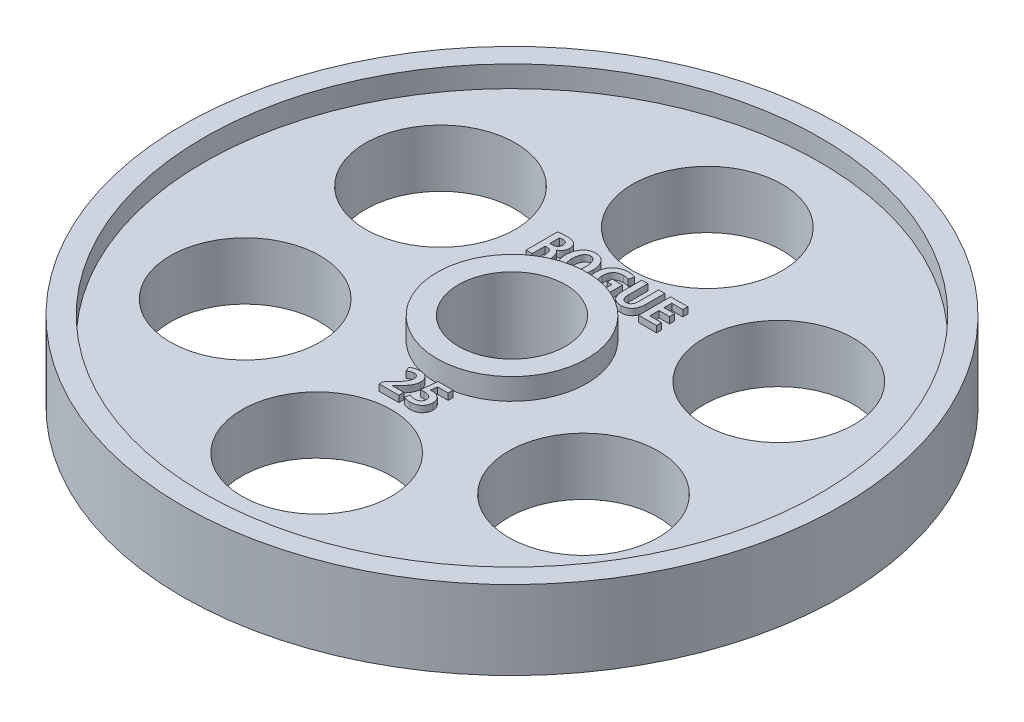
from build123d import *

# Parameters (mm, degrees)
SKETCH1_R               = 154
SKETCH1_R_2             = 25
BOSS_EXTRUDE1_DEPTH     = 18.415
SKETCH2_R               = 144
SKETCH2_R_2             = 35
CUT_EXTRUDE2_DEPTH      = 10
CUT_EXTRUDE3_DEPTH      = 220.435295475
CUT_EXTRUDE3_DEPTH_BACK = 220.435295475
SKETCH3_R               = 35
BOSS_EXTRUDE2_DEPTH     = 3


with BuildPart() as part:
    # Sketch1 → Boss-Extrude1 (new, symmetric)
    with BuildSketch(Plane(origin=(0, 0, 0), x_dir=(1, 0, 0), z_dir=(0, 1, 0))):
        with Locations(Location((0, 0, 0), (0, 0, 270))):
            Circle(SKETCH1_R)
        with Locations(Location((0, 0, 0), (0, 0, 270))):
            Circle(SKETCH1_R_2, mode=Mode.SUBTRACT)
    extrude(amount=BOSS_EXTRUDE1_DEPTH, both=True)

    # Sketch2 → Cut-Extrude2 (cut)
    with BuildSketch(Plane(origin=(0, 18.415, 0), x_dir=(1, 0, 0), z_dir=(0, 1, 0))):
        with Locations(Location((0, 0, 0), (0, 0, 270))):
            Circle(SKETCH2_R)
        with Locations(Location((0, 0, 0), (0, 0, 270))):
            Circle(SKETCH2_R_2, mode=Mode.SUBTRACT)
    extrude(amount=-CUT_EXTRUDE2_DEPTH, mode=Mode.SUBTRACT)

    # Sketch3 → Cut-Extrude3 (cut, two sides: drawn at the far end of the back side and taken through both)
    with BuildSketch(Plane(origin=(0, 8.415, 0), x_dir=(1, 0, 0), z_dir=(0, 1, 0)).offset(-CUT_EXTRUDE3_DEPTH_BACK)):
        with Locations(Location((0, 91.272564554, 0), (0, 0, 270))):
            Circle(SKETCH3_R)
        with Locations(Location((79.044359572, 45.636282277, 0), (0, 0, 270))):
            Circle(SKETCH3_R)
        with Locations(Location((79.044359572, -45.636282277, 0), (0, 0, 270))):
            Circle(SKETCH3_R)
        with Locations(Location((0, -91.272564554, 0), (0, 0, 270))):
            Circle(SKETCH3_R)
        with Locations(Location((-79.044359572, -45.636282277, 0), (0, 0, 270))):
            Circle(SKETCH3_R)
        with Locations(Location((-79.044359572, 45.636282277, 0), (0, 0, 270))):
            Circle(SKETCH3_R)
    extrude(amount=CUT_EXTRUDE3_DEPTH + CUT_EXTRUDE3_DEPTH_BACK, mode=Mode.SUBTRACT)

    # Sketch4 → Boss-Extrude2 (add)
    # profile 1 of 7: a face of its own
    with BuildSketch(Plane(origin=(0, 8.415, 0), x_dir=(1, 0, 0), z_dir=(0, 1, 0))):
        with BuildLine():
            Line((-30.195992688, 36.730082873), (-27.341586727, 36.730082873))
            Line((-27.341586727, 36.730082873), (-27.341586727, 42.843450395))
            Line((-27.341586727, 42.843450395), (-26.37254528, 42.843450395))
            add(Edge.make_bspline(
                [(-26.37254528, 42.843450395), (-26.291876974, 42.842870988), (-26.134950563, 42.84174385), (-25.906576065, 42.818650505), (-25.691744536, 42.780511356), (-25.490805471, 42.721616943), (-25.304979018, 42.641940527), (-25.131693034, 42.547550448), (-24.976709732, 42.430126424), (-24.833193615, 42.296508556), (-24.702812873, 42.137867029), (-24.578276061, 41.955666678), (-24.468617772, 41.742441474), (-24.359489708, 41.506724645), (-24.267338885, 41.241019796), (-24.175107893, 40.951645529), (-24.098559644, 40.63270231), (-24.052932627, 40.410597956), (-24.029242836, 40.295280187)],
                knots=[0, 0, 0, 0, 1.001974666, 1.949170552, 2.84847504, 3.710096242, 4.544408109, 5.357094972, 6.155407276, 6.953973995, 7.788367017, 8.701791117, 9.690949389, 10.763842173, 11.927092208, 13.182233812, 14.537000723, 16, 16, 16, 16], degree=3))
            add(Edge.make_bspline(
                [(-24.029242836, 40.295280187), (-23.986148772, 40.075013954), (-23.903305191, 39.651576428), (-23.769834223, 39.047264957), (-23.645923337, 38.497346562), (-23.518930314, 38.010195589), (-23.403370031, 37.586033626), (-23.292902241, 37.234752106), (-23.201953649, 36.952892164), (-23.132194418, 36.795236115), (-23.10212368, 36.727276165)],
                knots=[0, 0, 0, 0, 1.458923133, 2.804618726, 4.022904405, 5.122896265, 6.077023435, 6.879967071, 7.517193397, 8, 8, 8, 8], degree=3))
            Line((-23.10212368, 36.727276165), (-20.164487704, 36.730082873))
            add(Edge.make_bspline(
                [(-20.164487704, 36.730082873), (-20.2040284, 36.82035402), (-20.295051934, 37.028160147), (-20.408288543, 37.393268232), (-20.539719843, 37.842209777), (-20.671101356, 38.368245616), (-20.813191009, 38.95078505), (-20.95655604, 39.570908383), (-21.113597794, 40.216974747), (-21.215532704, 40.657598901), (-21.267551533, 40.882455652)],
                knots=[0, 0, 0, 0, 0.549570025, 1.265122049, 2.130097267, 3.160546163, 4.289861562, 5.476300611, 6.712120432, 8, 8, 8, 8], degree=3))
            add(Edge.make_bspline(
                [(-21.267551533, 40.882455652), (-21.311298371, 41.066869565), (-21.395464915, 41.421671937), (-21.566789194, 41.92145592), (-21.758260808, 42.373526307), (-21.979912128, 42.775345748), (-22.232437292, 43.127892144), (-22.529497451, 43.420680062), (-22.863472241, 43.662321829), (-23.112078583, 43.775513308), (-23.236977376, 43.832380237)],
                knots=[0, 0, 0, 0, 1.229855108, 2.366174558, 3.425587808, 4.413573034, 5.340237738, 6.230192189, 7.110855911, 8, 8, 8, 8], degree=3))
            Line((-23.236977376, 43.832380237), (-23.234612388, 43.891644859))
            add(Edge.make_bspline(
                [(-23.234612388, 43.891644859), (-23.061254494, 43.966844309), (-22.715291119, 44.116916827), (-22.244682652, 44.436991127), (-21.812618957, 44.816665151), (-21.493251384, 45.18572608), (-21.26948485, 45.513514513), (-21.120657107, 45.774521024), (-20.992970384, 46.048646427), (-20.889820458, 46.336882216), (-20.80460181, 46.637924005), (-20.743534336, 46.953690571), (-20.703387951, 47.282336984), (-20.695574684, 47.506092381), (-20.691613876, 47.619521514)],
                knots=[0, 0, 0, 0, 1.415251057, 2.824359598, 4.248283838, 5.723142377, 6.47158846, 7.223785845, 7.975195039, 8.737661918, 9.518558112, 10.320635523, 11.148673685, 12, 12, 12, 12], degree=3))
            add(Edge.make_bspline(
                [(-20.691613876, 47.619521514), (-20.699577699, 47.735785503), (-20.715228041, 47.96426511), (-20.761947453, 48.29669692), (-20.817314146, 48.613848946), (-20.886640251, 48.913363356), (-20.971724985, 49.196527111), (-21.069459015, 49.463325738), (-21.181034353, 49.713641517), (-21.308894192, 49.946070554), (-21.449419942, 50.161493337), (-21.5997885, 50.363910194), (-21.771392036, 50.542344043), (-21.950541553, 50.711168416), (-22.148011312, 50.858303629), (-22.357319267, 50.992720336), (-22.581925244, 51.106815879), (-22.895633034, 51.235379132), (-23.293653865, 51.367024164), (-23.762292694, 51.514081714), (-24.223934938, 51.624346886), (-24.671257076, 51.716881545), (-25.108820927, 51.776659736), (-25.534147072, 51.819711254), (-25.949223145, 51.826762424), (-26.221595344, 51.8144608), (-26.35546908, 51.808414425)],
                knots=[0, 0, 0, 0, 1.04254728, 2.048792541, 3.00224853, 3.923105087, 4.79804786, 5.646501919, 6.464227683, 7.248100506, 8.017504481, 8.765055913, 9.500244792, 10.229727568, 10.965537121, 11.700200404, 12.45355415, 13.216173449, 14.732128481, 16.203485081, 17.610025167, 18.977448705, 20.289434687, 21.560307215, 22.800865913, 24, 24, 24, 24], degree=3))
            add(Edge.make_bspline(
                [(-26.35546908, 51.808414425), (-26.713312889, 51.804207447), (-27.412743878, 51.795984612), (-28.271518631, 51.739564306), (-28.922795666, 51.678663381), (-29.374301325, 51.628445571), (-29.796879694, 51.572968413), (-30.067787327, 51.529044737), (-30.198799397, 51.507803063)],
                knots=[0, 0, 0, 0, 1.668967631, 3.262115064, 4.012317135, 4.719957541, 5.380966089, 6, 6, 6, 6], degree=3))
            Line((-30.198799397, 51.507803063), (-30.195992688, 36.730082873))
        make_face()
        with BuildLine():
            add(Edge.make_bspline(
                [(-27.341586727, 49.558688132), (-27.270702609, 49.576857816), (-27.104631745, 49.619426662), (-26.811201348, 49.649331291), (-26.442979082, 49.67263841), (-26.171988269, 49.673021594), (-26.023953746, 49.673230916)],
                knots=[0, 0, 0, 0, 0.661277559, 1.549274193, 2.661238647, 4, 4, 4, 4], degree=3))
            add(Edge.make_bspline(
                [(-26.023953746, 49.673230916), (-25.885029367, 49.674023883), (-25.605862266, 49.67561734), (-25.189911715, 49.594928594), (-24.781074105, 49.454596624), (-24.450001772, 49.291369662), (-24.201934162, 49.119048254), (-24.036448396, 48.955960473), (-23.896313482, 48.762461664), (-23.775573111, 48.540420193), (-23.687094776, 48.286069623), (-23.611700164, 48.005886033), (-23.565508919, 47.694842409), (-23.552698442, 47.477314041), (-23.546017094, 47.363861384)],
                knots=[0, 0, 0, 0, 1.292083092, 2.596427594, 3.923894466, 5.313341569, 6.020452472, 6.730143688, 7.466744382, 8.239869291, 9.076443159, 9.969725277, 10.941103348, 12, 12, 12, 12], degree=3))
            add(Edge.make_bspline(
                [(-23.546017094, 47.363861384), (-23.549193735, 47.275719168), (-23.555400979, 47.103486869), (-23.589838527, 46.852509133), (-23.642744322, 46.614212209), (-23.717658693, 46.389404079), (-23.817995379, 46.178967197), (-23.937837195, 45.982461754), (-24.081085413, 45.801376587), (-24.240251225, 45.632080002), (-24.420547284, 45.480781704), (-24.617542987, 45.34736545), (-24.834622093, 45.237888536), (-25.066809261, 45.145621435), (-25.316853295, 45.071763331), (-25.583085971, 45.019793179), (-25.866679572, 44.984988317), (-26.061306891, 44.97894295), (-26.161616893, 44.975827196)],
                knots=[0, 0, 0, 0, 1.059346065, 2.069991167, 3.039184971, 3.989375718, 4.910601955, 5.835121727, 6.749101981, 7.680445877, 8.622807178, 9.571664136, 10.532985652, 11.538164881, 12.57081342, 13.661090204, 14.794536924, 16, 16, 16, 16], degree=3))
            Line((-26.161616893, 44.975827196), (-27.341586727, 44.978633904))
            Line((-27.341586727, 44.978633904), (-27.341586727, 49.558688132))
        make_face(mode=Mode.SUBTRACT)
    # profile 2 of 7: a face of its own
    with BuildSketch(Plane(origin=(0, 8.415, 0), x_dir=(1, 0, 0), z_dir=(0, 1, 0))):
        with BuildLine():
            add(Edge.make_bspline(
                [(-12.659341264, 51.811221134), (-12.900480274, 51.799083816), (-13.372110368, 51.775345126), (-14.057360089, 51.660936845), (-14.703122441, 51.487711867), (-15.309491549, 51.248425834), (-15.874019023, 50.939429117), (-16.399646464, 50.568800272), (-16.887629926, 50.136652161), (-17.325228383, 49.637373289), (-17.721353053, 49.08993816), (-18.067791256, 48.498215799), (-18.360179335, 47.8653206), (-18.601788639, 47.193964679), (-18.79366347, 46.482866291), (-18.929523418, 45.731014328), (-19.014785231, 44.939347991), (-19.029386324, 44.398232949), (-19.036846657, 44.121753792)],
                knots=[0, 0, 0, 0, 1.033979396, 2.022301571, 2.970529521, 3.894611869, 4.808705929, 5.721706953, 6.645545269, 7.595046225, 8.560760165, 9.537443814, 10.528556773, 11.544132656, 12.591621816, 13.681030908, 14.81513806, 16, 16, 16, 16], degree=3))
            add(Edge.make_bspline(
                [(-19.036846657, 44.121753792), (-19.031338856, 43.85277336), (-19.020548559, 43.325815479), (-18.939458024, 42.555253129), (-18.815031902, 41.821422712), (-18.638049947, 41.124976585), (-18.410613257, 40.466142148), (-18.134193444, 39.844828273), (-17.810385346, 39.25998082), (-17.438136315, 38.716254082), (-17.021741983, 38.219404302), (-16.554927874, 37.785648789), (-16.042556311, 37.419749578), (-15.490524826, 37.112065236), (-14.892232981, 36.873583387), (-14.251699555, 36.697141584), (-13.567933174, 36.582694834), (-13.097177448, 36.561259866), (-12.856052288, 36.55028069)],
                knots=[0, 0, 0, 0, 1.175398352, 2.302715549, 3.382711972, 4.426044826, 5.439559783, 6.425314094, 7.394529886, 8.35725084, 9.301097905, 10.222100453, 11.134210928, 12.046578501, 12.977639436, 13.941864418, 14.945805126, 16, 16, 16, 16], degree=3))
            add(Edge.make_bspline(
                [(-12.856052288, 36.55028069), (-12.62535132, 36.55596007), (-12.172325123, 36.567112635), (-11.511702794, 36.662135898), (-10.884366178, 36.813453129), (-10.291796956, 37.026631877), (-9.733908436, 37.305480882), (-9.208686548, 37.641906604), (-8.72386152, 38.047289776), (-8.268891112, 38.503944919), (-7.860597602, 39.025734751), (-7.505388868, 39.610137779), (-7.201273823, 40.254153546), (-6.953207056, 40.95887109), (-6.756454759, 41.722159888), (-6.615348693, 42.54529138), (-6.525411155, 43.428724266), (-6.507492471, 44.038189451), (-6.498262443, 44.352128855)],
                knots=[0, 0, 0, 0, 0.973215927, 1.911098665, 2.810233662, 3.692878859, 4.562482505, 5.437306462, 6.318818337, 7.224297875, 8.153278156, 9.107653746, 10.104740014, 11.153537043, 12.255914066, 13.4274303, 14.674852943, 16, 16, 16, 16], degree=3))
            add(Edge.make_bspline(
                [(-6.498262443, 44.352128855), (-6.501904913, 44.603305458), (-6.50907013, 45.097402934), (-6.585553962, 45.822807851), (-6.701821959, 46.519784813), (-6.867087352, 47.188318673), (-7.084316204, 47.827887036), (-7.348779918, 48.438400913), (-7.658929472, 49.021181892), (-8.016536265, 49.570206278), (-8.420259335, 50.077474431), (-8.87931891, 50.523051522), (-9.389354363, 50.902613751), (-9.949829095, 51.215840755), (-10.559122134, 51.462892913), (-11.215229832, 51.649434749), (-11.921293093, 51.766940496), (-12.408916269, 51.794340193), (-12.659390649, 51.808414425)],
                knots=[0, 0, 0, 0, 1.108815589, 2.181186377, 3.217324289, 4.227359111, 5.218662007, 6.196651342, 7.162419235, 8.130521869, 9.086401898, 10.019355721, 10.947374437, 11.886103195, 12.846837522, 13.844349182, 14.892720183, 16, 16, 16, 16], degree=3))
            Line((-12.659390649, 51.808414425), (-12.659341264, 51.811221134))
        make_face()
        with BuildLine():
            add(Edge.make_bspline(
                [(-12.737182838, 49.496229954), (-12.604111217, 49.484163343), (-12.344709374, 49.460641414), (-11.969692732, 49.377189854), (-11.621790013, 49.242881247), (-11.301060652, 49.063026843), (-11.006554094, 48.836270008), (-10.739104551, 48.56513545), (-10.499166133, 48.247351257), (-10.29092283, 47.886754753), (-10.109889045, 47.495350037), (-9.943962016, 47.085019412), (-9.811799715, 46.653579285), (-9.697783415, 46.205820419), (-9.611633894, 45.739278589), (-9.550078205, 45.254382693), (-9.51282441, 44.751663127), (-9.509084207, 44.410254791), (-9.50718552, 44.236941323)],
                knots=[0, 0, 0, 0, 0.936463798, 1.82548641, 2.684127786, 3.542744044, 4.395260201, 5.282267079, 6.205678022, 7.180000722, 8.196506421, 9.228258241, 10.281381103, 11.358157126, 12.467215955, 13.606035564, 14.784721301, 16, 16, 16, 16], degree=3))
            add(Edge.make_bspline(
                [(-9.50718552, 44.236941323), (-9.509980285, 44.049572581), (-9.515464306, 43.681908631), (-9.555574035, 43.142728971), (-9.618919533, 42.628615127), (-9.709568691, 42.139016498), (-9.823446598, 41.67421456), (-9.963041689, 41.233022267), (-10.134058681, 40.819627905), (-10.321135899, 40.429983812), (-10.535887472, 40.075046598), (-10.778606096, 39.763339687), (-11.046012328, 39.495548083), (-11.342358845, 39.27855139), (-11.658828668, 39.100297633), (-12.003460543, 38.974764829), (-12.371845029, 38.890938287), (-12.627096395, 38.87395853), (-12.757721468, 38.865269126)],
                knots=[0, 0, 0, 0, 1.289934008, 2.531170484, 3.720374072, 4.854740059, 5.957213729, 7.013449117, 8.037165448, 9.034886746, 9.986980833, 10.887254569, 11.74895182, 12.583294381, 13.408695019, 14.241067112, 15.099864807, 16, 16, 16, 16], degree=3))
            add(Edge.make_bspline(
                [(-12.757721468, 38.865269126), (-12.887375686, 38.874038435), (-13.140705673, 38.891172695), (-13.508020032, 38.974133656), (-13.849339713, 39.104655044), (-14.169544641, 39.27718472), (-14.461911017, 39.499856021), (-14.735136879, 39.762795198), (-14.979613012, 40.075020519), (-15.195664259, 40.430057141), (-15.391223907, 40.815175549), (-15.559945191, 41.22804986), (-15.70211993, 41.663084054), (-15.820883596, 42.12087806), (-15.912865375, 42.602359974), (-15.980098587, 43.106912482), (-16.019545946, 43.635089024), (-16.025089891, 43.994325471), (-16.02792358, 44.177942832)],
                knots=[0, 0, 0, 0, 0.900670226, 1.759809896, 2.600946146, 3.429642157, 4.274359804, 5.142859609, 6.05415538, 7.017062466, 8.022526562, 9.048195907, 10.108477395, 11.19592731, 12.327557226, 13.507517, 14.726011367, 16, 16, 16, 16], degree=3))
            add(Edge.make_bspline(
                [(-16.02792358, 44.177942832), (-16.026058406, 44.352195613), (-16.02239394, 44.69454608), (-15.984810995, 45.199095958), (-15.92364538, 45.685933746), (-15.836578847, 46.155956402), (-15.724830145, 46.608428355), (-15.586682571, 47.042883831), (-15.423449115, 47.459645296), (-15.237318567, 47.856080018), (-15.028750188, 48.22533917), (-14.782442457, 48.547040844), (-14.510522164, 48.823955415), (-14.209787571, 49.053871361), (-13.881778724, 49.23800346), (-13.52518738, 49.374404154), (-13.1408656, 49.46181744), (-12.874283354, 49.482736166), (-12.738055304, 49.493425989)],
                knots=[0, 0, 0, 0, 1.205088424, 2.367609753, 3.497237102, 4.597454418, 5.672031744, 6.718840175, 7.748493441, 8.765539111, 9.746550106, 10.675452162, 11.559455099, 12.42358487, 13.284893858, 14.152222325, 15.055754259, 16, 16, 16, 16], degree=3))
            Line((-12.738055304, 49.493425989), (-12.737182838, 49.496229954))
        make_face(mode=Mode.SUBTRACT)
    # profile 3 of 7: a face of its own
    with BuildSketch(Plane(origin=(0, 8.415, 0), x_dir=(1, 0, 0), z_dir=(0, 1, 0))):
        with BuildLine():
            Line((1.631218854, 45.141582119), (1.631218854, 42.860307107))
            Line((1.631218854, 42.860307107), (3.78713579, 42.860307107))
            Line((3.78713579, 42.860307107), (3.78713579, 39.086093699))
            add(Edge.make_bspline(
                [(3.78713579, 39.086093699), (3.7500914, 39.068512426), (3.671474522, 39.031200846), (3.535964789, 38.995041521), (3.382722977, 38.957623813), (3.208031688, 38.927908791), (3.013273903, 38.901515299), (2.797354223, 38.887330921), (2.56053034, 38.871692425), (2.395555477, 38.867473284), (2.309369532, 38.865269126)],
                knots=[0, 0, 0, 0, 0.653154628, 1.386147199, 2.230860804, 3.172021168, 4.212071664, 5.366447579, 6.624183111, 8, 8, 8, 8], degree=3))
            add(Edge.make_bspline(
                [(2.309369532, 38.865269126), (2.155521831, 38.868378151), (1.852956474, 38.874492529), (1.411926579, 38.942382373), (0.99078753, 39.044287845), (0.593674548, 39.1961142), (0.214996634, 39.3827573), (-0.138876256, 39.616977674), (-0.47175636, 39.890441505), (-0.781350605, 40.206228008), (-1.063500048, 40.562109656), (-1.305399379, 40.963644717), (-1.514438675, 41.40375243), (-1.6834507, 41.886681921), (-1.822705521, 42.407504288), (-1.917656603, 42.970110833), (-1.984324014, 43.572388693), (-1.99673731, 43.98858262), (-2.003139266, 44.2032279)],
                knots=[0, 0, 0, 0, 0.953676512, 1.87555272, 2.761867879, 3.637011316, 4.507417159, 5.37595959, 6.263416516, 7.1754643, 8.114589267, 9.074123104, 10.077253866, 11.132050585, 12.243927563, 13.417825685, 14.668285404, 16, 16, 16, 16], degree=3))
            add(Edge.make_bspline(
                [(-2.003139266, 44.2032279), (-1.995907475, 44.41601169), (-1.981882936, 44.828661114), (-1.911163925, 45.425106784), (-1.802891884, 45.978904944), (-1.654823518, 46.487850914), (-1.469322127, 46.955207506), (-1.24116764, 47.376876073), (-0.977007879, 47.759214255), (-0.666848067, 48.090476573), (-0.329250242, 48.382330524), (0.031137881, 48.637492444), (0.417549637, 48.849017864), (0.824916587, 49.023191399), (1.255778492, 49.159345297), (1.709433879, 49.253565233), (2.186117813, 49.311312347), (2.511482602, 49.316562542), (2.677407743, 49.319239966)],
                knots=[0, 0, 0, 0, 1.298542789, 2.518250729, 3.66010011, 4.737713637, 5.747803493, 6.721842567, 7.65708385, 8.574936643, 9.482253959, 10.376304947, 11.263703582, 12.164756428, 13.075521448, 14.015723889, 14.988085666, 16, 16, 16, 16], degree=3))
            add(Edge.make_bspline(
                [(2.677407743, 49.319239966), (2.833830672, 49.316712024), (3.134762241, 49.311848688), (3.567271252, 49.285392578), (3.961639283, 49.23626436), (4.321595943, 49.176862218), (4.649272996, 49.094550169), (4.953656047, 49.01056915), (5.23251645, 48.908503193), (5.407634837, 48.831284454), (5.492478632, 48.793872445)],
                knots=[0, 0, 0, 0, 1.300829087, 2.50257772, 3.600788493, 4.604486954, 5.533740486, 6.408714025, 7.229031605, 8, 8, 8, 8], degree=3))
            Line((5.492478632, 48.793872445), (6.082419652, 51.175283569))
            add(Edge.make_bspline(
                [(6.082419652, 51.175283569), (5.985508896, 51.218848696), (5.781313121, 51.310642583), (5.448486879, 51.432888487), (5.06932298, 51.532890281), (4.651125792, 51.629309222), (4.194509725, 51.707441687), (3.704901871, 51.762777838), (3.183562574, 51.796178162), (2.825421616, 51.8023994), (2.640884867, 51.805604973)],
                knots=[0, 0, 0, 0, 0.723254479, 1.523933104, 2.410192463, 3.390746967, 4.445142521, 5.561749782, 6.743660119, 8, 8, 8, 8], degree=3))
            add(Edge.make_bspline(
                [(2.640884867, 51.805604973), (2.371823167, 51.798980683), (1.84414311, 51.785989217), (1.071371262, 51.688382978), (0.335341741, 51.531484747), (-0.365809761, 51.314771844), (-1.031141384, 51.037222828), (-1.658221997, 50.693638391), (-2.251122068, 50.293650704), (-2.712151178, 49.910936672), (-3.056369223, 49.574350427), (-3.300081198, 49.307881847), (-3.529942991, 49.028861602), (-3.739230208, 48.733855135), (-3.933925254, 48.426045295), (-4.114174427, 48.105898836), (-4.277410083, 47.770978913), (-4.422541439, 47.421309126), (-4.556395179, 47.059611314), (-4.666579767, 46.682272316), (-4.765321808, 46.29347364), (-4.851148823, 45.891901229), (-4.913530009, 45.475005823), (-4.965007692, 45.045102525), (-4.99902164, 44.600787618), (-5.00767369, 44.299741211), (-5.012062343, 44.14703886)],
                knots=[0, 0, 0, 0, 1.588252423, 3.114858529, 4.590810091, 6.026612173, 7.441653233, 8.839609889, 10.241268389, 11.658554554, 12.370162762, 13.082415096, 13.78967092, 14.503124065, 15.216405789, 15.939266766, 16.671226771, 17.414686674, 18.173812935, 18.947024519, 19.734205331, 20.542085796, 21.370222467, 22.222016626, 23.098138246, 24, 24, 24, 24], degree=3))
            add(Edge.make_bspline(
                [(-5.012062343, 44.14703886), (-5.004389995, 43.848983969), (-4.989364734, 43.265283582), (-4.891023828, 42.410554064), (-4.72421575, 41.598091207), (-4.534452047, 40.950518922), (-4.351168888, 40.458084715), (-4.198129574, 40.107861843), (-4.03304827, 39.773610737), (-3.853445409, 39.455287616), (-3.657855839, 39.154930553), (-3.454965165, 38.86653021), (-3.231101731, 38.598938181), (-3.071648728, 38.43176529), (-2.992066365, 38.348329961)],
                knots=[0, 0, 0, 0, 1.704842656, 3.338704885, 4.913464543, 6.443981355, 7.193187298, 7.917665265, 8.629154765, 9.324799911, 10.00680261, 10.678695983, 11.34054239, 12, 12, 12, 12], degree=3))
            add(Edge.make_bspline(
                [(-2.992066365, 38.348329961), (-2.831550452, 38.201832749), (-2.510077082, 37.908435343), (-1.963891216, 37.541142321), (-1.372852285, 37.23049641), (-0.734772111, 36.978160527), (-0.049870328, 36.780930707), (0.68172866, 36.642307754), (1.460835308, 36.559157745), (1.995434741, 36.553293116), (2.270037205, 36.55028069)],
                knots=[0, 0, 0, 0, 0.913036649, 1.828584863, 2.758893342, 3.717094375, 4.709404796, 5.752305212, 6.845448596, 8, 8, 8, 8], degree=3))
            add(Edge.make_bspline(
                [(2.270037205, 36.55028069), (2.481780206, 36.554685821), (2.898292771, 36.563351008), (3.511292626, 36.612974104), (4.102927515, 36.685123219), (4.666945141, 36.782865655), (5.192079712, 36.89735164), (5.666116185, 37.017597684), (6.084067298, 37.13901006), (6.339470542, 37.231744629), (6.458930116, 37.275119302)],
                knots=[0, 0, 0, 0, 1.189863118, 2.340539873, 3.45407261, 4.538092694, 5.555811396, 6.473485662, 7.286004554, 8, 8, 8, 8], degree=3))
            Line((6.458930116, 37.275119302), (6.461736824, 45.141582119))
            Line((6.461736824, 45.141582119), (1.631218854, 45.141582119))
        make_face()
    # profile 4 of 7: a face of its own
    with BuildSketch(Plane(origin=(0, 8.415, 0), x_dir=(1, 0, 0), z_dir=(0, 1, 0))):
        with BuildLine():
            Line((16.912895468, 51.631416207), (16.912895468, 42.623553161))
            add(Edge.make_bspline(
                [(16.912895468, 42.623553161), (16.909790094, 42.463602432), (16.903803823, 42.155263218), (16.869798162, 41.711040896), (16.817961687, 41.300705121), (16.742334264, 40.924301727), (16.647488146, 40.580298833), (16.533585685, 40.268770749), (16.395567587, 39.991974049), (16.237585138, 39.74743603), (16.059863522, 39.536308598), (15.86588265, 39.353073651), (15.655896934, 39.198407959), (15.428008166, 39.073404761), (15.184425842, 38.977293674), (14.924901305, 38.910659612), (14.6488538, 38.869860305), (14.459460483, 38.86682987), (14.361918552, 38.865269126)],
                knots=[0, 0, 0, 0, 1.490335628, 2.872940429, 4.148958373, 5.341678511, 6.44675969, 7.471071941, 8.42710538, 9.322567927, 10.177224934, 10.992023476, 11.803545021, 12.600201061, 13.407112453, 14.236726727, 15.091873547, 16, 16, 16, 16], degree=3))
            add(Edge.make_bspline(
                [(14.361918552, 38.865269126), (14.269081914, 38.866999782), (14.087197727, 38.870390457), (13.82170962, 38.909521999), (13.571953198, 38.980722126), (13.336423838, 39.080370101), (13.113897161, 39.206379482), (12.907181177, 39.362330145), (12.71717803, 39.548544478), (12.539814034, 39.762278935), (12.378901998, 40.007381957), (12.241598722, 40.286301731), (12.12321571, 40.596450707), (12.029725859, 40.940387278), (11.954362974, 41.314931706), (11.898111448, 41.721089063), (11.865297233, 42.160228609), (11.859097946, 42.464122202), (11.855887381, 42.621506431)],
                knots=[0, 0, 0, 0, 0.874083262, 1.712491184, 2.51954072, 3.31419991, 4.116267761, 4.922593724, 5.746109999, 6.616982005, 7.534547127, 8.501142007, 9.539883987, 10.65717316, 11.854422601, 13.136974088, 14.517260191, 16, 16, 16, 16], degree=3))
            Line((11.855887381, 42.621506431), (11.855887381, 51.631416207))
            Line((11.855887381, 51.631416207), (9.001481419, 51.631416207))
            Line((9.001481419, 51.631416207), (9.001481419, 42.875396937))
            add(Edge.make_bspline(
                [(9.001481419, 42.875396937), (9.005782481, 42.611767512), (9.014102289, 42.101812968), (9.078124731, 41.364413505), (9.186702898, 40.681645746), (9.337974468, 40.053111995), (9.527610629, 39.476580563), (9.76017316, 38.952412606), (10.038774108, 38.483850311), (10.359066761, 38.069094352), (10.718919657, 37.706054549), (11.117816946, 37.393129753), (11.55330976, 37.12559854), (12.029806236, 36.914217557), (12.539697872, 36.742370367), (13.089154478, 36.631829113), (13.673423604, 36.557648105), (14.076039013, 36.552784072), (14.283253896, 36.55028069)],
                knots=[0, 0, 0, 0, 1.341228934, 2.594421284, 3.762393366, 4.855664785, 5.8802742, 6.846423615, 7.767372286, 8.64706517, 9.506232889, 10.361281592, 11.220964451, 12.099559776, 13.008148492, 13.952947907, 14.946439577, 16, 16, 16, 16], degree=3))
            add(Edge.make_bspline(
                [(14.283253896, 36.55028069), (14.493224467, 36.553030452), (14.902266081, 36.558387236), (15.497837306, 36.629665745), (16.057380077, 36.75061378), (16.581702847, 36.917721008), (17.069290957, 37.13631366), (17.522257415, 37.400648216), (17.93819265, 37.717858858), (18.315392537, 38.08538356), (18.657615601, 38.500851035), (18.947883534, 38.974609782), (19.200456467, 39.498149109), (19.403162918, 40.076363669), (19.563092842, 40.706326925), (19.676399763, 41.388597442), (19.74650869, 42.12373543), (19.758368298, 42.631646907), (19.764494721, 42.894023274)],
                knots=[0, 0, 0, 0, 1.052294924, 2.049965448, 3.001336543, 3.919006355, 4.803859469, 5.675191847, 6.542936471, 7.419566364, 8.310577297, 9.234341309, 10.19829392, 11.22007025, 12.300820344, 13.453312577, 14.684434938, 16, 16, 16, 16], degree=3))
            Line((19.764494721, 42.894023274), (19.767301429, 51.631416207))
            Line((19.767301429, 51.631416207), (16.912895468, 51.631416207))
        make_face()
    # profile 5 of 7: a face of its own
    with BuildSketch(Plane(origin=(0, 8.415, 0), x_dir=(1, 0, 0), z_dir=(0, 1, 0))):
        Polygon((25.341256913, 39.045074053), (25.341256913, 43.382865176), (30.215486005, 43.382865176), (30.215486005, 45.697853612), (25.341256913, 45.697853612), (25.341256913, 49.316425027), (30.506774596, 49.316425027), (30.506774596, 51.631416207), (22.486850952, 51.631416207), (22.486850952, 36.730085617), (30.817482427, 36.730085617), (30.817482427, 39.045074053), align=None)
    # profile 6 of 7: a face of its own
    with BuildSketch(Plane(origin=(0, 8.415, 0), x_dir=(1, 0, 0), z_dir=(0, 1, 0))):
        with BuildLine():
            Line((-6.556714958, -49.390172675), (-6.556714958, -49.35110922))
            Line((-6.556714958, -49.35110922), (-5.333302875, -48.140142132))
            add(Edge.make_bspline(
                [(-5.333302875, -48.140142132), (-5.068890479, -47.87304773), (-4.548588367, -47.347468053), (-3.829561895, -46.526728772), (-3.180363024, -45.694925281), (-2.683539829, -44.995053015), (-2.334372192, -44.423652837), (-2.108308511, -43.988053612), (-1.914580566, -43.545179343), (-1.753352445, -43.093824613), (-1.626567665, -42.634636535), (-1.533894907, -42.167024642), (-1.473968683, -41.690898108), (-1.459675031, -41.370286033), (-1.452486677, -41.209048492)],
                knots=[0, 0, 0, 0, 1.659202022, 3.264923779, 4.814209511, 6.316896139, 7.051567576, 7.769144172, 8.482047353, 9.1843673, 9.883576409, 10.583408793, 11.287588645, 12, 12, 12, 12], degree=3))
            add(Edge.make_bspline(
                [(-1.452486677, -41.209048492), (-1.454426724, -41.058120636), (-1.458246164, -40.760983561), (-1.510956729, -40.324994156), (-1.594286817, -39.906319566), (-1.714264085, -39.506760241), (-1.874035274, -39.127741809), (-2.064828786, -38.766929103), (-2.291774025, -38.424582197), (-2.551842451, -38.101653458), (-2.848770241, -37.803914332), (-3.189989009, -37.548309538), (-3.566079624, -37.32665513), (-3.983059013, -37.147713061), (-4.436951455, -37.004997263), (-4.928836354, -36.899382639), (-5.458647891, -36.827646081), (-5.825627545, -36.813789187), (-6.015036702, -36.80663723)],
                knots=[0, 0, 0, 0, 1.009543328, 1.987524111, 2.933968874, 3.863854154, 4.774078899, 5.682489326, 6.591612952, 7.518557726, 8.453666412, 9.397555261, 10.363899254, 11.368743061, 12.427215963, 13.543452787, 14.732102632, 16, 16, 16, 16], degree=3))
            add(Edge.make_bspline(
                [(-6.015036702, -36.80663723), (-6.224095805, -36.813654456), (-6.635121572, -36.827450846), (-7.237736194, -36.903995183), (-7.813915944, -37.027408086), (-8.358185963, -37.196885282), (-8.867891007, -37.394575295), (-9.333343785, -37.617209915), (-9.757598385, -37.852315345), (-10.008988998, -38.037356486), (-10.130883861, -38.127079663)],
                knots=[0, 0, 0, 0, 1.142131743, 2.245516072, 3.313064714, 4.356728811, 5.356075675, 6.296497493, 7.174001758, 8, 8, 8, 8], degree=3))
            Line((-10.130883861, -38.127079663), (-9.333666193, -40.190729148))
            add(Edge.make_bspline(
                [(-9.333666193, -40.190729148), (-9.245179251, -40.125543665), (-9.062760702, -39.99116179), (-8.76905236, -39.804487551), (-8.449403977, -39.627788584), (-8.111508812, -39.458992328), (-7.753799922, -39.31498108), (-7.380448454, -39.207482491), (-6.993328293, -39.138114906), (-6.729857244, -39.125298678), (-6.596593263, -39.118816214)],
                knots=[0, 0, 0, 0, 0.882381775, 1.819057125, 2.791981266, 3.814391476, 4.850565017, 5.88354078, 6.929492323, 8, 8, 8, 8], degree=3))
            add(Edge.make_bspline(
                [(-6.596593263, -39.118816214), (-6.50001394, -39.122880557), (-6.312751078, -39.13076113), (-6.042094514, -39.167763295), (-5.791666944, -39.222861223), (-5.560492484, -39.29904716), (-5.350094089, -39.396894187), (-5.159723484, -39.515067), (-4.992090062, -39.655501791), (-4.793986285, -39.864269191), (-4.59659035, -40.167609854), (-4.421178938, -40.568561008), (-4.322015382, -41.013239916), (-4.312047301, -41.321878267), (-4.306889894, -41.481565334)],
                knots=[0, 0, 0, 0, 0.93230204, 1.807690748, 2.631964675, 3.403485345, 4.151360469, 4.865902888, 5.558923755, 6.255646087, 7.636553115, 9.02477282, 10.460640741, 12, 12, 12, 12], degree=3))
            add(Edge.make_bspline(
                [(-4.306889894, -41.481565334), (-4.312039441, -41.604456656), (-4.322427306, -41.852357812), (-4.381551759, -42.224424651), (-4.470449528, -42.6012355), (-4.602669422, -42.980401877), (-4.765491447, -43.365411245), (-4.962958116, -43.754399907), (-5.197896804, -44.145927834), (-5.469992062, -44.542433109), (-5.774597381, -44.948826331), (-6.108026243, -45.37074933), (-6.4668073, -45.812484783), (-6.858159891, -46.269887005), (-7.278609126, -46.744792864), (-7.733232334, -47.232634555), (-8.212237156, -47.741597876), (-8.54490984, -48.083325722), (-8.71492006, -48.257963525)],
                knots=[0, 0, 0, 0, 0.714042855, 1.440395043, 2.184640807, 2.96058558, 3.769988571, 4.611854656, 5.492656414, 6.420700846, 7.404361908, 8.442699269, 9.544774642, 10.710251598, 11.939640591, 13.229377797, 14.584091463, 16, 16, 16, 16], degree=3))
            Line((-8.71492006, -48.257963525), (-10.343466643, -49.99243797))
            Line((-10.343466643, -49.99243797), (-10.343466643, -51.705161111))
            Line((-10.343466643, -51.705161111), (-1.177810617, -51.705161111))
            Line((-1.177810617, -51.705161111), (-1.177810617, -49.390172675))
            Line((-1.177810617, -49.390172675), (-6.556714958, -49.390172675))
        make_face()
    # profile 7 of 7: a face of its own
    with BuildSketch(Plane(origin=(0, 8.415, 0), x_dir=(1, 0, 0), z_dir=(0, 1, 0))):
        with BuildLine():
            add(Edge.make_bspline(
                [(1.586240186, -44.411214675), (1.706386199, -44.397309513), (1.958980728, -44.368075352), (2.355026902, -44.343094706), (2.784858552, -44.320832021), (3.081933084, -44.319700516), (3.236488688, -44.31911184)],
                knots=[0, 0, 0, 0, 0.877454455, 1.844756985, 2.878716113, 4, 4, 4, 4], degree=3))
            add(Edge.make_bspline(
                [(3.236488688, -44.31911184), (3.387326264, -44.321147095), (3.680034864, -44.32509662), (4.105077803, -44.358978318), (4.500920915, -44.414852204), (4.869327477, -44.489907088), (5.208527506, -44.5875617), (5.520957488, -44.705988589), (5.805613596, -44.844896308), (6.059891665, -45.009580604), (6.286636358, -45.191724378), (6.482182229, -45.396359995), (6.648716462, -45.618695986), (6.785626724, -45.860059102), (6.889138695, -46.121422859), (6.965612703, -46.401064787), (7.010240791, -46.700113606), (7.017241178, -46.905534215), (7.020820513, -47.010566843)],
                knots=[0, 0, 0, 0, 1.376975805, 2.672097174, 3.889715345, 5.024935981, 6.101897443, 7.108622118, 8.072196835, 8.987646619, 9.868961103, 10.721607246, 11.564639608, 12.399262134, 13.247093457, 14.1244591, 15.041026163, 16, 16, 16, 16], degree=3))
            add(Edge.make_bspline(
                [(7.020820513, -47.010566843), (7.015372275, -47.110991012), (7.004723485, -47.307273925), (6.954694504, -47.591788722), (6.887331812, -47.860580496), (6.787247986, -48.108456506), (6.665150937, -48.339371769), (6.519432799, -48.553487398), (6.346709932, -48.748902991), (6.149401051, -48.921620641), (5.936007119, -49.075553626), (5.710411337, -49.210774912), (5.474941762, -49.326825534), (5.228294771, -49.417672529), (4.974474858, -49.497804802), (4.706974027, -49.543789133), (4.431532486, -49.581101823), (4.244284429, -49.584908578), (4.149560583, -49.586834314)],
                knots=[0, 0, 0, 0, 1.117583691, 2.184360454, 3.207534369, 4.193945161, 5.149122039, 6.108265851, 7.067522763, 8.041482217, 9.018611016, 9.990340196, 10.963909721, 11.93306774, 12.911749652, 13.918839882, 14.947196064, 16, 16, 16, 16], degree=3))
            add(Edge.make_bspline(
                [(4.149560583, -49.586834314), (4.008982558, -49.583071389), (3.731896411, -49.57565448), (3.324533904, -49.532758106), (2.933230303, -49.465671841), (2.561660166, -49.3748722), (2.21577774, -49.273157354), (1.901244298, -49.162188798), (1.621421126, -49.050396267), (1.451034333, -48.964258193), (1.371012569, -48.923803645)],
                knots=[0, 0, 0, 0, 1.17104461, 2.308186058, 3.408530927, 4.475634886, 5.492545615, 6.410316856, 7.253408985, 8, 8, 8, 8], degree=3))
            Line((1.371012569, -48.923803645), (0.80947061, -51.101128934))
            add(Edge.make_bspline(
                [(0.80947061, -51.101128934), (0.908794083, -51.15240097), (1.117579118, -51.26017845), (1.464038409, -51.396377013), (1.855131779, -51.520971599), (2.287727702, -51.638242507), (2.754770868, -51.741071639), (3.25112785, -51.806910064), (3.769208145, -51.859091829), (4.123194931, -51.865059749), (4.304080442, -51.868109326)],
                knots=[0, 0, 0, 0, 0.742744707, 1.56130243, 2.470949386, 3.470792521, 4.54051912, 5.647308622, 6.797786247, 8, 8, 8, 8], degree=3))
            add(Edge.make_bspline(
                [(4.304080442, -51.868109326), (4.516008461, -51.859475535), (4.929184036, -51.842643067), (5.530263644, -51.758769153), (6.096308203, -51.636717909), (6.627606407, -51.471555788), (7.122430193, -51.260656513), (7.579990429, -51.002731781), (8.003886107, -50.704705177), (8.388168866, -50.363639766), (8.732077994, -49.99232282), (9.031860478, -49.595326097), (9.290506097, -49.179330452), (9.496306076, -48.73832796), (9.666059079, -48.280845027), (9.78211597, -47.799850697), (9.85733693, -47.298524647), (9.869203174, -46.956522359), (9.875223731, -46.783001232)],
                knots=[0, 0, 0, 0, 1.206264818, 2.351737923, 3.448157932, 4.498117667, 5.51266174, 6.502772445, 7.481504261, 8.455495724, 9.420819422, 10.356539462, 11.282329499, 12.2023817, 13.121090432, 14.054197148, 15.012761268, 16, 16, 16, 16], degree=3))
            add(Edge.make_bspline(
                [(9.875223731, -46.783001232), (9.864985782, -46.594551576), (9.845140071, -46.229252099), (9.769005034, -45.700317802), (9.639193747, -45.21153937), (9.47796233, -44.756438866), (9.262156904, -44.343386169), (9.013840765, -43.96163755), (8.712906817, -43.624133322), (8.37315913, -43.326437917), (8.006415196, -43.06464062), (7.62032955, -42.835662623), (7.215678941, -42.643528531), (6.794106182, -42.487500476), (6.35629889, -42.360678987), (5.900385478, -42.279700818), (5.428184705, -42.226668712), (5.107734673, -42.220686511), (4.944635495, -42.217641755)],
                knots=[0, 0, 0, 0, 1.197180487, 2.32066969, 3.382793817, 4.401622341, 5.376880326, 6.332686038, 7.284030491, 8.235374944, 9.193394283, 10.139043906, 11.079883983, 12.031228436, 12.988584225, 13.967509591, 14.965525106, 16, 16, 16, 16], degree=3))
            add(Edge.make_bspline(
                [(4.944635495, -42.217641755), (4.803948606, -42.219416161), (4.531172578, -42.222856534), (4.26081328, -42.259093061), (4.129894419, -42.276640247)],
                knots=[0, 0, 0, 0, 1.03151945, 2, 2, 2, 2], degree=3))
            Line((4.129894419, -42.276640247), (4.518545337, -39.298626629))
            Line((4.518545337, -39.298626629), (9.475576442, -39.298626629))
            Line((9.475576442, -39.298626629), (9.475576442, -36.983635449))
            Line((9.475576442, -36.983635449), (2.479525199, -36.983635449))
            Line((2.479525199, -36.983635449), (1.586240186, -44.411214675))
        make_face()
    extrude(amount=BOSS_EXTRUDE2_DEPTH)


solid = part.part
